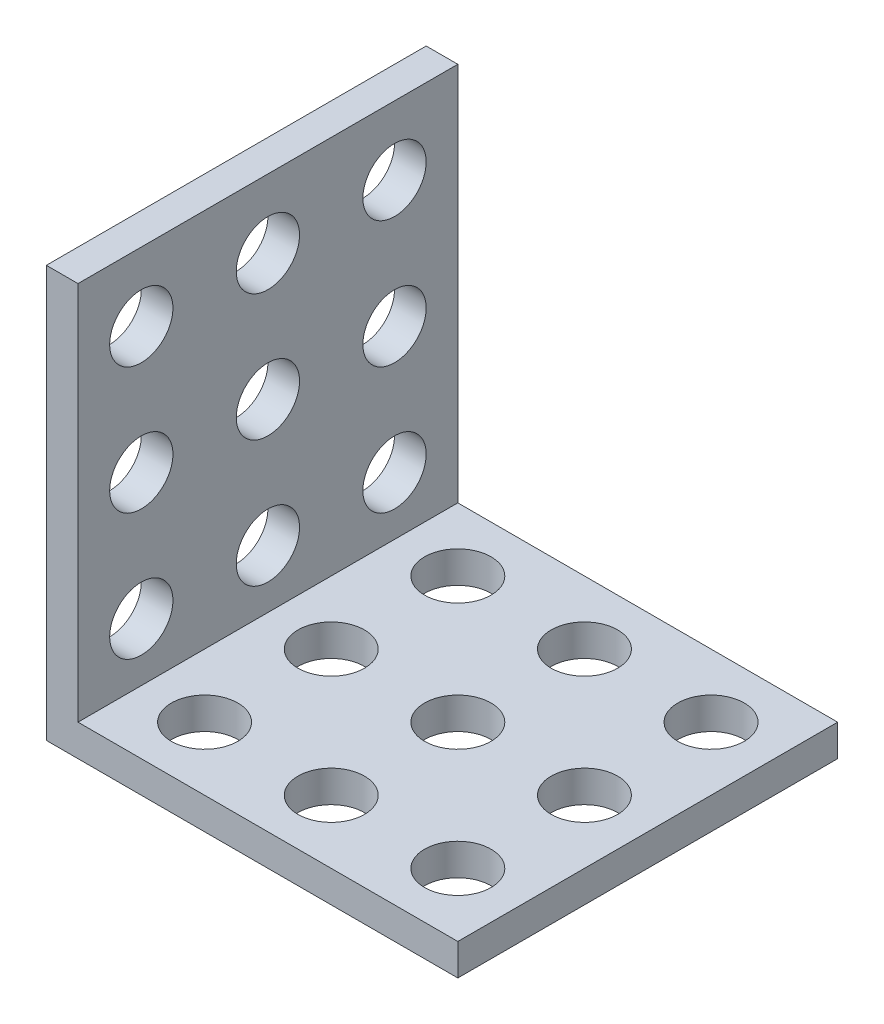
from build123d import *

# Parameters (mm, degrees)
SKETCH1_W           = 24
SKETCH1_H           = 24
SKETCH1_R           = 2.1
BOSS_EXTRUDE1_DEPTH = 2
SKETCH2_W           = 24
SKETCH2_H           = 26
SKETCH2_R           = 2
BOSS_EXTRUDE2_DEPTH = 2


with BuildPart() as part:
    # Sketch1 → Boss-Extrude1 (new body)
    with BuildSketch(Plane(origin=(0, 0, 0), x_dir=(1, 0, 0), z_dir=(0, 1, 0))):
        with Locations((12, 0)):
            Rectangle(SKETCH1_W, SKETCH1_H)
        with Locations(Location((4, 8, 0), (0, 0, 270))):
            Circle(SKETCH1_R, mode=Mode.SUBTRACT)
        with Locations(Location((12, 8, 0), (0, 0, 270))):
            Circle(SKETCH1_R, mode=Mode.SUBTRACT)
        with Locations(Location((20, 8, 0), (0, 0, 270))):
            Circle(SKETCH1_R, mode=Mode.SUBTRACT)
        with Locations(Location((12, 0, 0), (0, 0, 270))):
            Circle(SKETCH1_R, mode=Mode.SUBTRACT)
        with Locations(Location((20, 0, 0), (0, 0, 270))):
            Circle(SKETCH1_R, mode=Mode.SUBTRACT)
        with Locations(Location((12, -8, 0), (0, 0, 270))):
            Circle(SKETCH1_R, mode=Mode.SUBTRACT)
        with Locations(Location((20, -8, 0), (0, 0, 270))):
            Circle(SKETCH1_R, mode=Mode.SUBTRACT)
        with Locations(Location((4, 0, 0), (0, 0, 270))):
            Circle(SKETCH1_R, mode=Mode.SUBTRACT)
        with Locations(Location((4, -8, 0), (0, 0, 270))):
            Circle(SKETCH1_R, mode=Mode.SUBTRACT)
    extrude(amount=BOSS_EXTRUDE1_DEPTH)

    # Sketch2 → Boss-Extrude2 (add)
    with BuildSketch(Plane.ZY):
        with Locations((0, 13)):
            Rectangle(SKETCH2_W, SKETCH2_H)
        with Locations((-8, 21.666666667)):
            Circle(SKETCH2_R, mode=Mode.SUBTRACT)
        with Locations((0, 21.666666667)):
            Circle(SKETCH2_R, mode=Mode.SUBTRACT)
        with Locations((8, 21.666666667)):
            Circle(SKETCH2_R, mode=Mode.SUBTRACT)
        with Locations((0, 13.666666667)):
            Circle(SKETCH2_R, mode=Mode.SUBTRACT)
        with Locations((8, 13.666666667)):
            Circle(SKETCH2_R, mode=Mode.SUBTRACT)
        with Locations((0, 5.666666667)):
            Circle(SKETCH2_R, mode=Mode.SUBTRACT)
        with Locations((8, 5.666666667)):
            Circle(SKETCH2_R, mode=Mode.SUBTRACT)
        with Locations((-8, 13.666666667)):
            Circle(SKETCH2_R, mode=Mode.SUBTRACT)
        with Locations((-8, 5.666666667)):
            Circle(SKETCH2_R, mode=Mode.SUBTRACT)
    extrude(amount=BOSS_EXTRUDE2_DEPTH)


solid = part.part
